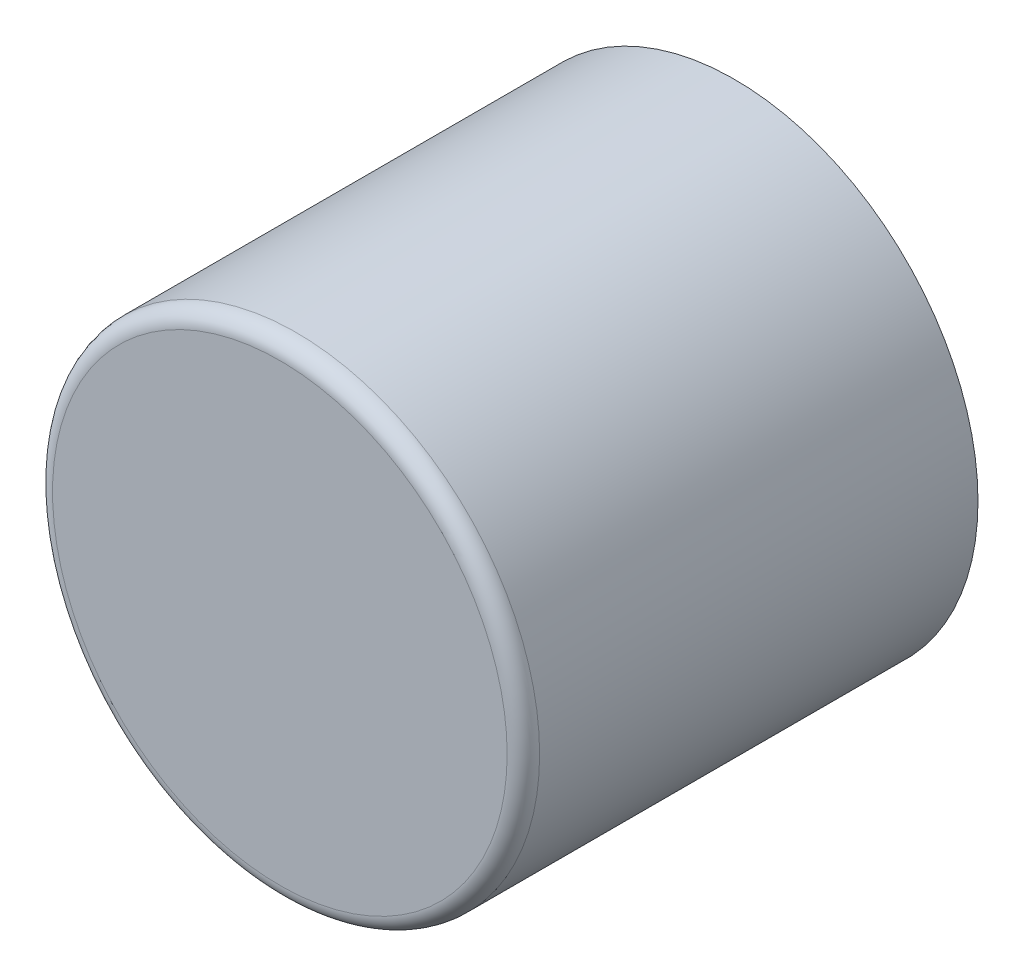
from build123d import *

# Parameters (mm, degrees)
SKETCH1_R                 = 7.5
BOSS_EXTRUDE1_DEPTH       = 14
M8X1_0_TAPPED_HOLE1_D     = 7
M8X1_0_TAPPED_HOLE1_DEPTH = 10
M8X1_0_TAPPED_HOLE1_TIP   = 2.020725942
FILLET1_R                 = 0.5


with BuildPart() as part:
    # Sketch1 → Boss-Extrude1 (new body)
    with BuildSketch(Plane.XY):
        Circle(SKETCH1_R)
    extrude(amount=BOSS_EXTRUDE1_DEPTH)

    # M8x1.0 Tapped Hole1
    with Locations(Plane(origin=(0, 0, 0), x_dir=(-1, 0, 0), z_dir=(0, 0, -1))):
        with Locations((0, 0)):
            Hole(M8X1_0_TAPPED_HOLE1_D / 2, depth=M8X1_0_TAPPED_HOLE1_DEPTH)
            with Locations((0, 0, -(M8X1_0_TAPPED_HOLE1_DEPTH + M8X1_0_TAPPED_HOLE1_TIP / 2))):  # 120° drill point
                Cone(0, M8X1_0_TAPPED_HOLE1_D / 2, M8X1_0_TAPPED_HOLE1_TIP, mode=Mode.SUBTRACT)

    # Fillet1
    fillet1_edges = [part.edges().sort_by_distance(p)[0] for p in [
        (-7.5, 0, 14),
    ]]
    fillet(fillet1_edges, radius=FILLET1_R)


solid = part.part
